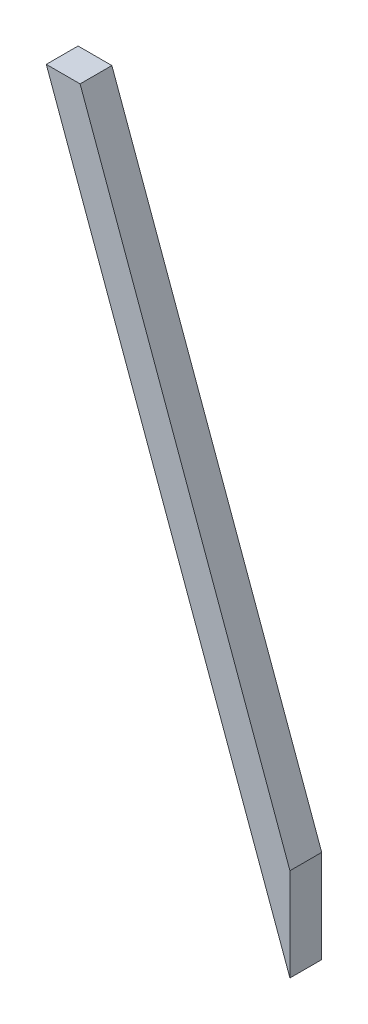
from build123d import *

# Parameters (mm, degrees)
BOSS_EXTRUDE1_DEPTH = 6


with BuildPart() as part:
    # Sketch1 → Boss-Extrude1 (new body)
    with BuildSketch(Plane(origin=(0, 0, 0), x_dir=(0, 1, 0), z_dir=(0, 0, 1))):
        Polygon((-49.744667945, 1.799110577), (76.662783403, 47.807660257), (76.662783403, 41.422593622), (-32.201841544, 1.799110577), align=None)
    extrude(amount=BOSS_EXTRUDE1_DEPTH)


solid = part.part
